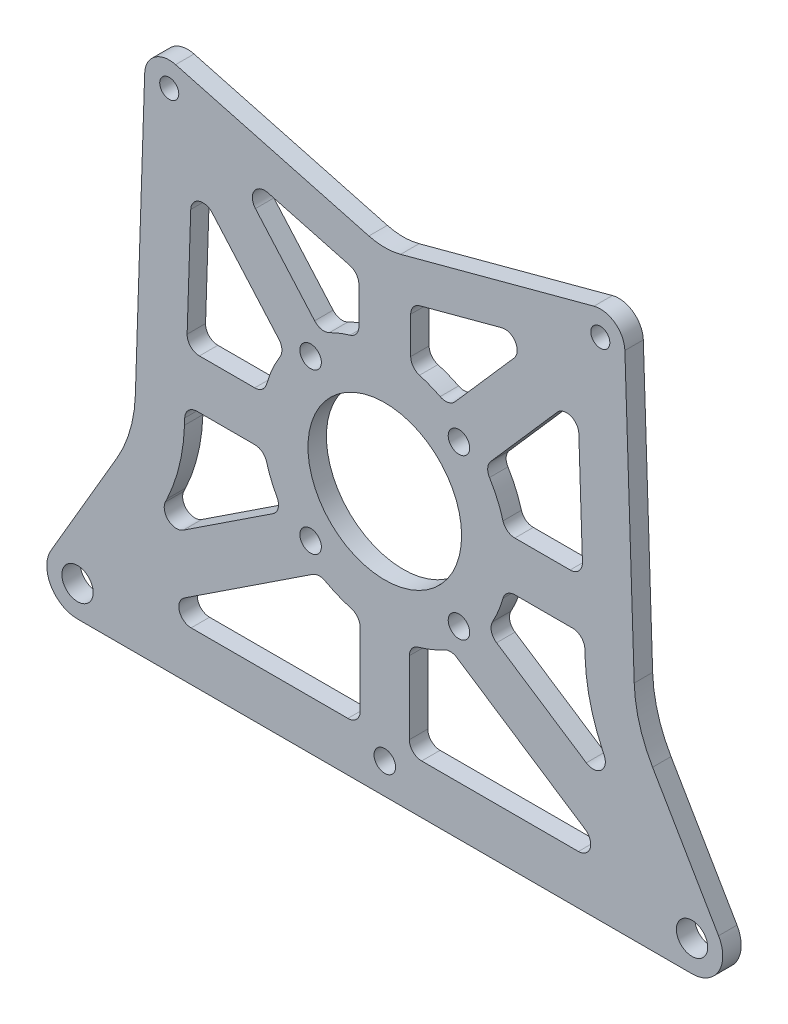
from build123d import *

# Parameters (mm, degrees)
SKETCH_1_R             = 1.75
SKETCH_1_R_2           = 4
SKETCH_1_R_3           = 1.55
SKETCH_1_R_4           = 5
SKETCH_1_R_5           = 2.55
EXTRUDE_1_DEPTH        = 3
FILLET_1_R             = 10
SKETCH_2_R             = 1.75
CUT_EXTRUDE_1_DEPTH    = 3
CUT_EXTRUDE_2_DEPTH    = 10
FILLET_2_R             = 2
FILLET_2_OF_MIRROR_2_R = 2
SKETCH_5_R             = 12.5
CUT_EXTRUDE_3_DEPTH    = 10
EXTRUDE_2_DEPTH        = 3
FILLET_3_R             = 2
FILLET_4_R             = 2


with BuildPart() as part:
    # 草图1 → 凸台-拉伸1 (new body)
    # profile 1 of 3: a face of its own
    with BuildSketch(Plane.XY):
        with BuildLine():
            ThreePointArc((-31.074028853, 87.25), (-35.139866152, 83.250541855), (-39.071861578, 87.38165676))
            Line((-39.071861578, 87.38165676), (-40.590218292, 41.27588782))
            ThreePointArc((-40.590218292, 41.27588782), (-41.439715326, 35.904074252), (-43.581025503, 30.904792609))
            Line((-43.581025503, 30.904792609), (-54.317561995, 12.521638043))
            ThreePointArc((-54.317561995, 12.521638043), (-48.693824279, 14.826375968), (-45, 10))
            ThreePointArc((-45, 10), (-46.464466094, 6.464466094), (-50, 5))
            Line((-50, 5), (0, 5))
            Line((0, 5), (0, 82))
            Line((0, 82), (-34.039489079, 91.113900549))
            ThreePointArc((-34.039489079, 91.113900549), (-31.900847556, 89.685348117), (-31.074028853, 87.25))
        make_face()
        with Locations((-12.07, 35)):
            Circle(SKETCH_1_R, mode=Mode.SUBTRACT)
        with Locations((-12.07, 61)):
            Circle(SKETCH_1_R, mode=Mode.SUBTRACT)
    # profile 2 of 3: a face of its own
    with BuildSketch(Plane.XY):
        with Locations((-35.074028853, 87.25)):
            Circle(SKETCH_1_R_2)
        with Locations((-35.074028853, 87.25)):
            Circle(SKETCH_1_R_3, mode=Mode.SUBTRACT)
    # profile 3 of 3: a face of its own
    with BuildSketch(Plane.XY):
        with Locations((-50, 10)):
            Circle(SKETCH_1_R_4)
        with Locations((-50, 10)):
            Circle(SKETCH_1_R_5, mode=Mode.SUBTRACT)
    extrude_1 = extrude(amount=EXTRUDE_1_DEPTH)

    # 镜向1: 凸台-拉伸1 across plane
    add(extrude_1.mirror(Plane(origin=(0, 0, 3), x_dir=(0, 0, 1), z_dir=(-1, 0, 0))))

    # 圆角1
    fillet_1_edges = [part.edges().sort_by_distance(p)[0] for p in [
        (0, 82, 1.5),
    ]]
    fillet(fillet_1_edges, radius=FILLET_1_R)

    # 草图2 → 切除-拉伸1 (cut)
    with BuildSketch(Plane.XY.offset(3)):
        with Locations((0, 10)):
            Circle(SKETCH_2_R)
    extrude(amount=-CUT_EXTRUDE_1_DEPTH, mode=Mode.SUBTRACT)

    # 草图4 → 切除-拉伸2 (cut)
    with BuildSketch(Plane.XY.offset(3)):
        with BuildLine():
            ThreePointArc((-10.354163178, 65.111145633), (-7.386964112, 66.58582151), (-4.21701247, 67.550365875))
            Line((-4.21701247, 67.550365875), (-4.21701247, 76.60212181))
            Line((-4.21701247, 76.60212181), (-25.392834673, 82.271840799))
            Line((-25.392834673, 82.271840799), (-10.354163178, 65.111145633))
        make_face()
        with BuildLine():
            ThreePointArc((-16.581442579, 36.817166638), (-19.997686263, 48.304210684), (-16.233615619, 59.682025678))
            Line((-16.233615619, 59.682025678), (-31.409439241, 76.999225749))
            Line((-31.409439241, 76.999225749), (-32.594552841, 41.0125743))
            ThreePointArc((-32.594552841, 41.0125743), (-33.411565317, 34.978483904), (-35.430174477, 29.233662466))
            Line((-35.430174477, 29.233662466), (-38.728362293, 22.219935083))
            Line((-38.728362293, 22.219935083), (-16.581442579, 36.817166638))
        make_face()
        with BuildLine():
            Line((-4, 13), (-4, 28.404082058))
            ThreePointArc((-4, 28.404082058), (-7.476808875, 29.45013938), (-10.707211367, 31.107527572))
            Line((-10.707211367, 31.107527572), (-12.178851974, 30.137556172))
            Line((-12.178851974, 30.137556172), (-34.325771688, 15.540324618))
            Line((-34.325771688, 15.540324618), (-38.179952199, 13))
            Line((-38.179952199, 13), (-4, 13))
        make_face()
    cut_extrude_2 = extrude(amount=-CUT_EXTRUDE_2_DEPTH, mode=Mode.SUBTRACT)

    # 圆角2
    fillet_2_edges = [part.edges().sort_by_distance(p)[0] for p in [
        (-31.409439241, 76.999225749, 1.5),
        (-16.233615619, 59.682025678, 1.5),
        (-16.581442579, 36.817166638, 1.5),
        (-38.728362293, 22.219935083, 1.5),
        (-10.707211367, 31.107527572, 1.5),
        (-4, 28.404082058, 1.5),
        (-4, 13, 1.5),
        (-38.179952199, 13, 1.5),
        (-4.21701247, 67.550365875, 1.5),
        (-10.354163178, 65.111145633, 1.5),
        (-25.392834673, 82.271840799, 1.5),
        (-4.21701247, 76.60212181, 1.5),
    ]]
    fillet(fillet_2_edges, radius=FILLET_2_R)

    # 镜向2: 切除-拉伸2 across plane
    add(cut_extrude_2.mirror(Plane(origin=(0, 0, 0), x_dir=(0, 0, 1), z_dir=(1, 0, 0))), mode=Mode.SUBTRACT)

    # 圆角2 of 镜向2
    fillet_2_of_mirror_2_edges = [part.edges().sort_by_distance(p)[0] for p in [
        (31.409439241, 76.999225749, 1.5),
        (16.233615619, 59.682025678, 1.5),
        (16.581442579, 36.817166638, 1.5),
        (38.728362293, 22.219935083, 1.5),
        (10.707211367, 31.107527572, 1.5),
        (4, 28.404082058, 1.5),
        (4, 13, 1.5),
        (38.179952199, 13, 1.5),
        (4.21701247, 67.550365875, 1.5),
        (10.354163178, 65.111145633, 1.5),
        (25.392834673, 82.271840799, 1.5),
        (4.21701247, 76.60212181, 1.5),
    ]]
    fillet(fillet_2_of_mirror_2_edges, radius=FILLET_2_OF_MIRROR_2_R)

    # 草图5 → 切除-拉伸3 (cut)
    with BuildSketch(Plane.XY.offset(3)):
        with Locations((0, 48)):
            Circle(SKETCH_5_R)
    extrude(amount=-CUT_EXTRUDE_3_DEPTH, mode=Mode.SUBTRACT)

    # 草图6 → 凸台-拉伸2 (add)
    with BuildSketch(Plane.XY.offset(3)):
        with BuildLine():
            Line((-32.364442706, 48), (-20, 48))
            ThreePointArc((-20, 48), (-19.89872306, 50.01017924), (-19.595917942, 52))
            Line((-19.595917942, 52), (-32.232714574, 52))
            Line((-32.232714574, 52), (-32.364442706, 48))
        make_face()
        with BuildLine():
            ThreePointArc((-19.595917942, 44), (-19.89872306, 45.98982076), (-20, 48))
            Line((-20, 48), (-32.364442706, 48))
            Line((-32.364442706, 48), (-32.496170839, 44))
            Line((-32.496170839, 44), (-19.595917942, 44))
        make_face()
    extrude_2 = extrude(amount=-EXTRUDE_2_DEPTH)

    # 镜向3: 凸台-拉伸2 across plane
    add(extrude_2.mirror(Plane(origin=(0, 0, 0), x_dir=(0, 0, 1), z_dir=(1, 0, 0))))

    # 圆角3
    fillet_3_edges = [part.edges().sort_by_distance(p)[0] for p in [
        (-19.595917942, 52, 1.5),
        (-19.595917942, 44, 1.5),
        (-32.496170839, 44, 1.5),
        (-32.232714574, 52, 1.5),
    ]]
    fillet(fillet_3_edges, radius=FILLET_3_R)

    # 圆角4
    fillet_4_edges = [part.edges().sort_by_distance(p)[0] for p in [
        (19.595917942, 44, 1.5),
        (19.595917942, 52, 1.5),
        (32.232714574, 52, 1.5),
        (32.496170839, 44, 1.5),
    ]]
    fillet(fillet_4_edges, radius=FILLET_4_R)


solid = part.part
